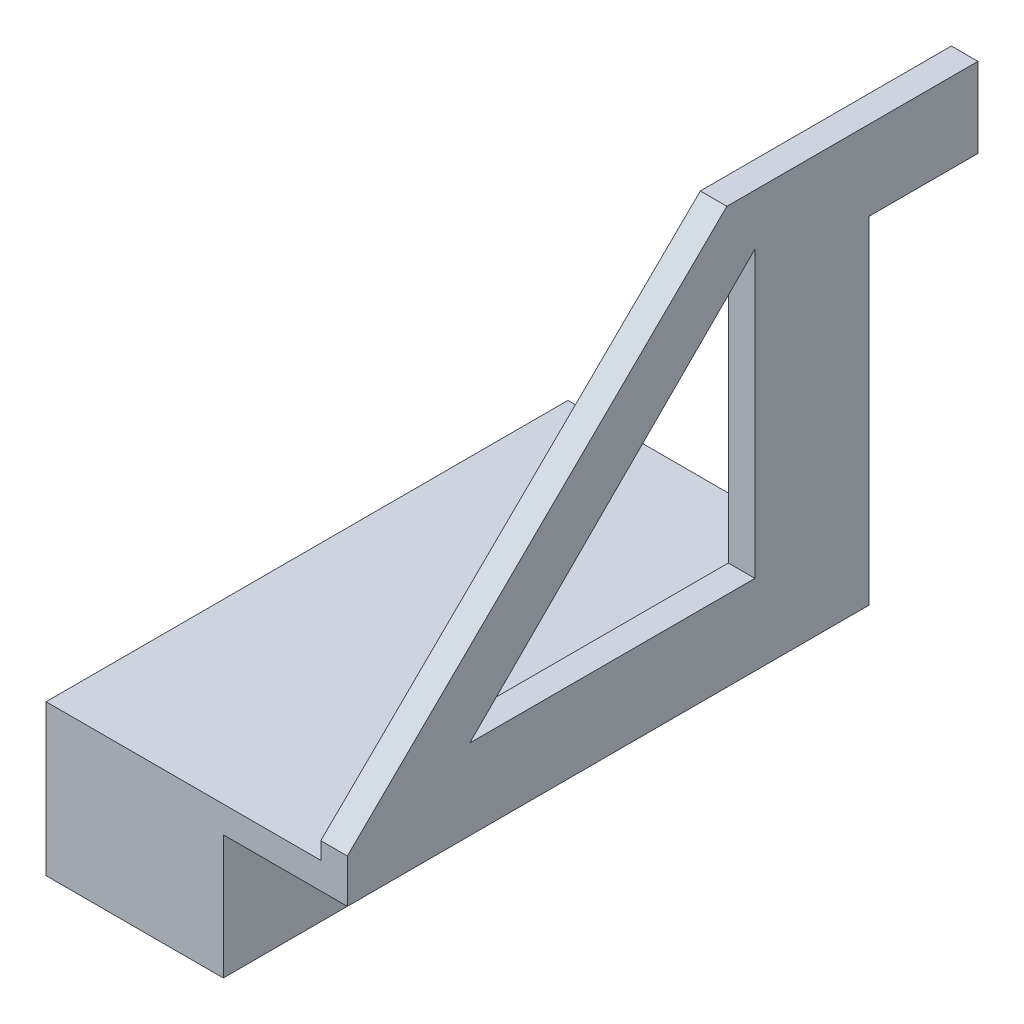
from build123d import *

# Parameters (mm, degrees)
SKETCH_2_W          = 17
SKETCH_2_H          = 35
EXTRUDE_1_DEPTH     = 1.5
SKETCH_3_W          = 10
SKETCH_3_H          = 35
EXTRUDE_2_DEPTH     = 7
SKETCH_4_W          = 1.5
SKETCH_4_H          = 35.577657925
EXTRUDE_3_DEPTH     = 22
CUT_EXTRUDE_1_REACH = 47.902
CUT_EXTRUDE_2_REACH = 47.902
SKETCH_11_W         = 17
SKETCH_11_H         = 6.846873931
CUT_EXTRUDE_7_DEPTH = 26


with BuildPart() as part:
    # 草图2 → 凸台-拉伸1 (new body)
    with BuildSketch(Plane(origin=(0, 0, 0), x_dir=(1, 0, 0), z_dir=(0, 1, 0))):
        with Locations((8.5, 17.5)):
            Rectangle(SKETCH_2_W, SKETCH_2_H)
    extrude(amount=EXTRUDE_1_DEPTH)

    # 草图3 → 凸台-拉伸2 (add)
    with BuildSketch(Plane.XZ):
        with Locations((5, -17.5)):
            Rectangle(SKETCH_3_W, SKETCH_3_H)
    extrude(amount=EXTRUDE_2_DEPTH)

    # 草图4 → 凸台-拉伸3 (add)
    with BuildSketch(Plane(origin=(0, 1.5, 0), x_dir=(1, 0, 0), z_dir=(0, 1, 0))):
        with Locations((16.25, 17.788828963)):
            Rectangle(SKETCH_4_W, SKETCH_4_H)
    extrude(amount=EXTRUDE_3_DEPTH)

    # 草图7 → 切除-拉伸1 (cut, up to next)
    with BuildSketch(Plane(origin=(17, 0, 0), x_dir=(0, 0, -1), z_dir=(1, 0, 0)), mode=Mode.PRIVATE) as cut_extrude_1_sk1:
        Polygon((0, 23.5), (0, 2.460497923), (21.413333868, 23.5), align=None)
    cut_extrude_1_tool1 = extrude(cut_extrude_1_sk1.sketch, amount=-CUT_EXTRUDE_1_REACH, mode=Mode.PRIVATE) & part.part
    add(cut_extrude_1_tool1.solids().sort_by_distance((17, 16.486833, -7.137778))[0], mode=Mode.SUBTRACT)

    # 草图8 → 切除-拉伸2 (cut, up to next)
    with BuildSketch(Plane(origin=(17, 0, 0), x_dir=(0, 0, -1), z_dir=(1, 0, 0)), mode=Mode.PRIVATE) as cut_extrude_2_sk1:
        Polygon((22.994680785, 20.618265403), (6.90545418, 4.529038798), (22.994680785, 4.529038798), align=None)
    cut_extrude_2_tool1 = extrude(cut_extrude_2_sk1.sketch, amount=-CUT_EXTRUDE_2_REACH, mode=Mode.PRIVATE) & part.part
    add(cut_extrude_2_tool1.solids().sort_by_distance((17, 9.892114, -17.631605))[0], mode=Mode.SUBTRACT)

    # 草图11 → 切除-拉伸7 (cut)
    with BuildSketch(Plane.XZ.offset(7)):
        with Locations((8.5, -32.86825369)):
            Rectangle(SKETCH_11_W, SKETCH_11_H)
    extrude(amount=-CUT_EXTRUDE_7_DEPTH, mode=Mode.SUBTRACT)


solid = part.part
